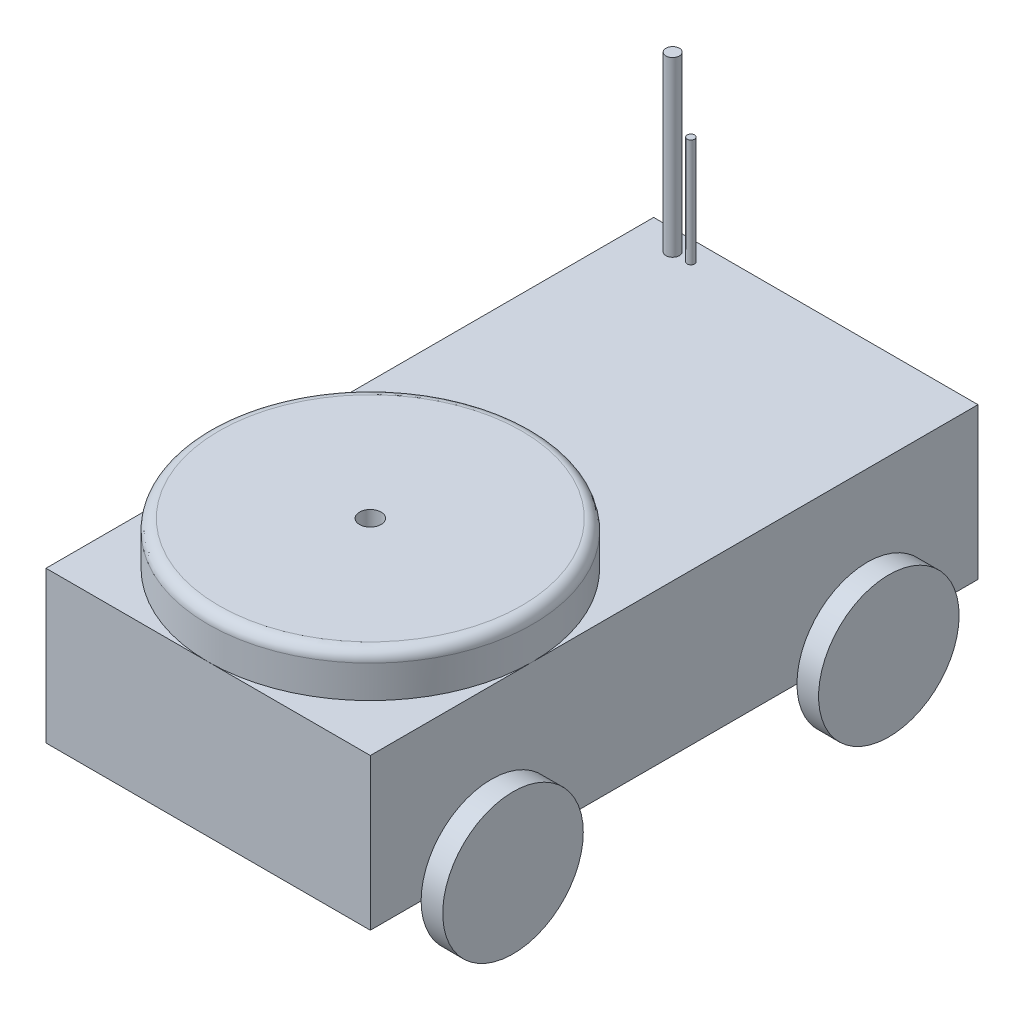
from build123d import *

# Parameters (mm, degrees)
SKETCH1_R           = 75
BOSS_EXTRUDE1_DEPTH = 20
FILLET4_R           = 5
CUT_EXTRUDE1_START  = 10
SKETCH2_R           = 5
CUT_EXTRUDE1_DEPTH  = 10
SKETCH3_W           = 150
SKETCH3_H           = 281.035433198
BOSS_EXTRUDE2_DEPTH = 70
SKETCH4_R           = 32.5
BOSS_EXTRUDE3_DEPTH = 10
SKETCH6_R           = 32.5
BOSS_EXTRUDE4_DEPTH = 10
BOSS_EXTRUDE5_START = 10
SKETCH8_R           = 32.5
BOSS_EXTRUDE5_DEPTH = 10
BOSS_EXTRUDE6_START = 10
SKETCH9_R           = 32.5
BOSS_EXTRUDE6_DEPTH = 10
SKETCH10_R          = 3.109945618
BOSS_EXTRUDE7_DEPTH = 80
SKETCH11_R          = 1.721500876
BOSS_EXTRUDE8_DEPTH = 50


with BuildPart() as part:
    # Sketch1 → Boss-Extrude1 (new body)
    with BuildSketch(Plane(origin=(0, 0, 0), x_dir=(1, 0, 0), z_dir=(0, 1, 0))):
        with Locations(Location((0, 0, 0), (0, 0, 270))):
            Circle(SKETCH1_R)
    extrude(amount=BOSS_EXTRUDE1_DEPTH)

    # Fillet4
    fillet4_edges = [part.edges().sort_by_distance(p)[0] for p in [
        (0, 20, -75),
    ]]
    fillet(fillet4_edges, radius=FILLET4_R)

    # Sketch2 → Cut-Extrude1 (cut)
    with BuildSketch(Plane(origin=(0, 0, 0), x_dir=(1, 0, 0), z_dir=(0, 1, 0)).offset(CUT_EXTRUDE1_START)):
        with Locations(Location((0, 0, 0), (0, 0, 270))):
            Circle(SKETCH2_R)
    extrude(amount=CUT_EXTRUDE1_DEPTH, mode=Mode.SUBTRACT)

    # Sketch3 → Boss-Extrude2 (add)
    with BuildSketch(Plane.XZ):
        with Locations((0, -65.517716599)):
            Rectangle(SKETCH3_W, SKETCH3_H)
    extrude(amount=BOSS_EXTRUDE2_DEPTH)

    # Sketch4 → Boss-Extrude3 (add)
    with BuildSketch(Plane.ZY.offset(75)):
        with Locations((-154.802708443, -70)):
            Circle(SKETCH4_R)
    extrude(amount=BOSS_EXTRUDE3_DEPTH)

    # Sketch6 → Boss-Extrude4 (add)
    with BuildSketch(Plane.ZY.offset(75)):
        with Locations((19.016258359, -70)):
            Circle(SKETCH6_R)
    extrude(amount=BOSS_EXTRUDE4_DEPTH)

    # Sketch8 → Boss-Extrude5 (add)
    with BuildSketch(Plane(origin=(75, 0, 0), x_dir=(0, 0, -1), z_dir=(1, 0, 0)).offset(BOSS_EXTRUDE5_START)):
        with Locations(Location((-19.016258359, -70, 0), (0, 0, 180))):
            Circle(SKETCH8_R)
    extrude(amount=-BOSS_EXTRUDE5_DEPTH)

    # Sketch9 → Boss-Extrude6 (add)
    with BuildSketch(Plane(origin=(75, 0, 0), x_dir=(0, 0, -1), z_dir=(1, 0, 0)).offset(BOSS_EXTRUDE6_START)):
        with Locations(Location((154.802708443, -70, 0), (0, 0, 180))):
            Circle(SKETCH9_R)
    extrude(amount=-BOSS_EXTRUDE6_DEPTH)

    # Sketch10 → Boss-Extrude7 (add)
    with BuildSketch(Plane(origin=(0, 0, 0), x_dir=(1, 0, 0), z_dir=(0, 1, 0))):
        with Locations(Location((-56.826635482, 196.658461897, 0), (0, 0, 90))):
            Circle(SKETCH10_R)
    extrude(amount=BOSS_EXTRUDE7_DEPTH)

    # Sketch11 → Boss-Extrude8 (add)
    with BuildSketch(Plane(origin=(0, 0, 0), x_dir=(1, 0, 0), z_dir=(0, 1, 0))):
        with Locations(Location((-48.57774745, 196.85215418, 0), (0, 0, 90))):
            Circle(SKETCH11_R)
    extrude(amount=BOSS_EXTRUDE8_DEPTH)


solid = part.part
